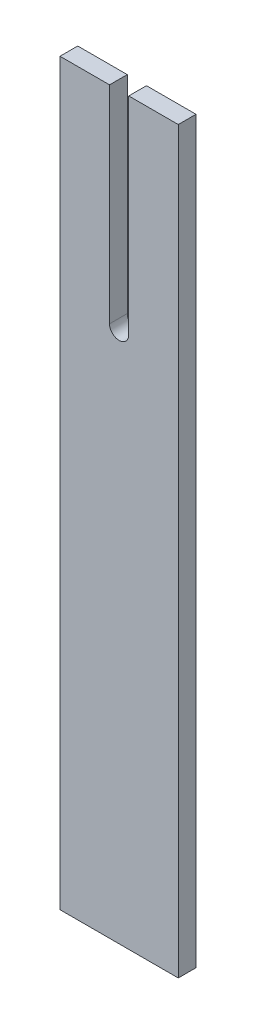
from build123d import *

# Parameters (mm, degrees)
SKETCH1_W           = 40
SKETCH1_H           = 250
BOSS_EXTRUDE1_DEPTH = 6
CUT_EXTRUDE1_DEPTH  = 6


with BuildPart() as part:
    # Sketch1 → Boss-Extrude1 (new body)
    with BuildSketch(Plane.XY):
        Rectangle(SKETCH1_W, SKETCH1_H)
    extrude(amount=BOSS_EXTRUDE1_DEPTH)

    # Sketch2 → Cut-Extrude1 (cut)
    with BuildSketch(Plane.XY.offset(6)):
        with BuildLine():
            Line((-3.25, 125), (3.25, 125))
            Line((3.25, 125), (3.25, 55))
            ThreePointArc((3.25, 55), (0, 51.75), (-3.25, 55))
            Line((-3.25, 55), (-3.25, 125))
        make_face()
    extrude(amount=-CUT_EXTRUDE1_DEPTH, mode=Mode.SUBTRACT)


solid = part.part
